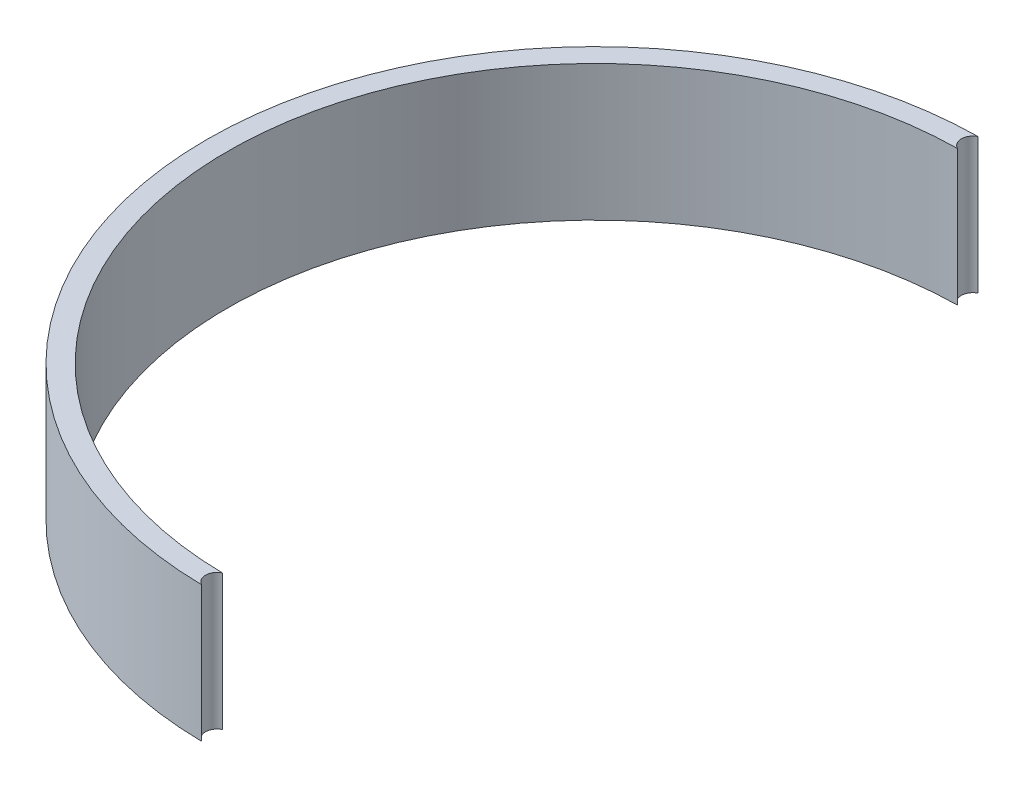
from build123d import *

# Parameters (mm, degrees)
BOSS_EXTRUDE1_DEPTH = 10


with BuildPart() as part:
    # Sketch1 → Boss-Extrude1 (new body)
    with BuildSketch(Plane(origin=(0, 0, 0), x_dir=(1, 0, 0), z_dir=(0, 1, 0))):
        with BuildLine():
            ThreePointArc((-0.374429978, -27.092412724), (-0.849980259, -27.849706909), (-0.384796444, -28.613412724))
            ThreePointArc((-0.384796444, -28.613412724), (-28.616, 0), (-0.384796444, 28.613412724))
            ThreePointArc((-0.384796444, 28.613412724), (-0.849980259, 27.849706909), (-0.374429978, 27.092412724))
            ThreePointArc((-0.374429978, 27.092412724), (-27.095, 0), (-0.374429978, -27.092412724))
        make_face()
    extrude(amount=BOSS_EXTRUDE1_DEPTH)


solid = part.part
